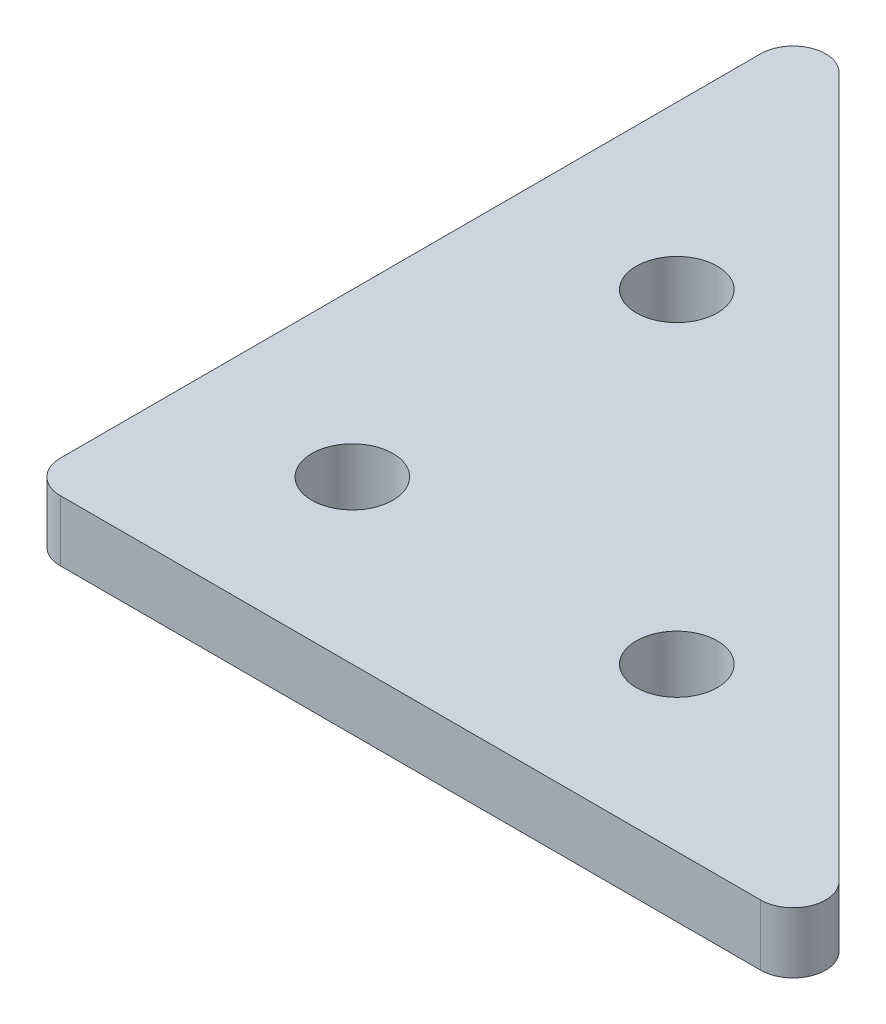
from build123d import *

# Parameters (mm, degrees)
BOSS_EXTRUDE1_DEPTH         = 4.7625
F_1_4_0_25_DIAMETER_HOLE1_D = 6.35


with BuildPart() as part:
    # Sketch1 → Boss-Extrude1 (new body)
    with BuildSketch(Plane(origin=(0, 0, 0), x_dir=(1, 0, 0), z_dir=(0, 1, 0))):
        with BuildLine():
            Line((-431.938028743, -442.700646237), (-377.110131192, -442.700646237))
            ThreePointArc((-377.110131192, -442.700646237), (-374.763477179, -441.132662155), (-375.314079967, -438.364595013))
            Line((-375.314079967, -438.364595013), (-430.141977519, -383.536697461))
            ThreePointArc((-430.141977519, -383.536697461), (-432.910044661, -382.986094673), (-434.478028743, -385.332748685))
            Line((-434.478028743, -385.332748685), (-434.478028743, -440.160646237))
            ThreePointArc((-434.478028743, -440.160646237), (-433.734079967, -441.956697461), (-431.938028743, -442.700646237))
        make_face()
    extrude(amount=BOSS_EXTRUDE1_DEPTH)

    # 1/4 (0.25) Diameter Hole1 (through all)
    with Locations(Plane(origin=(0, 4.7625, 0), x_dir=(1, 0, 0), z_dir=(0, 1, 0))):
        with Locations((-421.778028743, -404.600646237), (-421.778028743, -430.000646237), (-396.378028755, -430.000646237)):
            Hole(F_1_4_0_25_DIAMETER_HOLE1_D / 2)


solid = part.part
